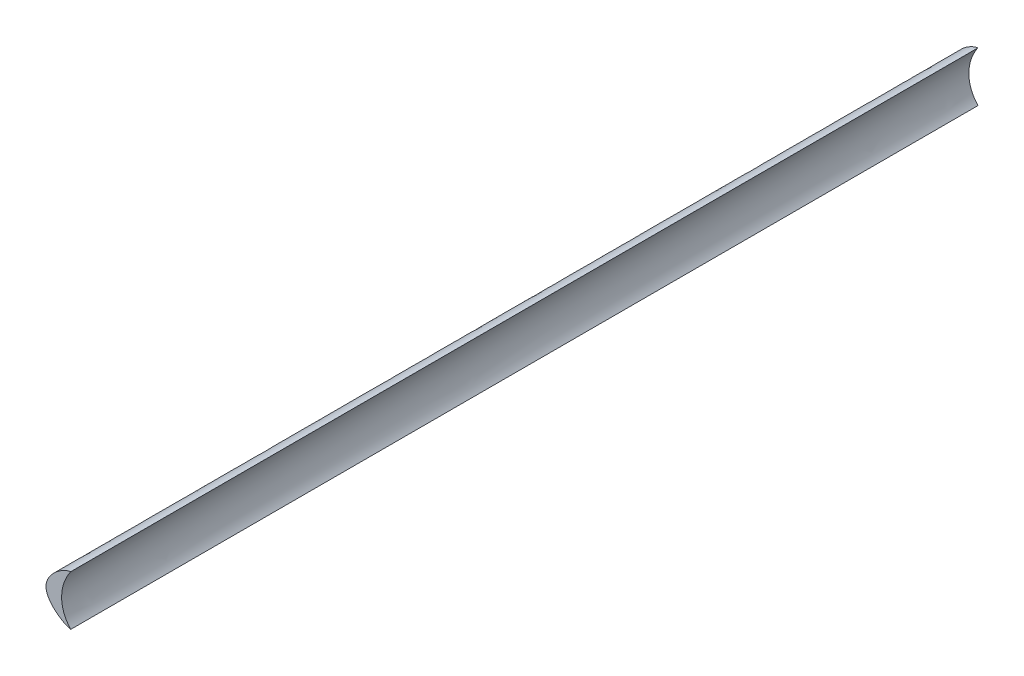
from build123d import *

# Parameters (mm, degrees)
BOSS_EXTRUDE1_DEPTH      = 350
BOSS_EXTRUDE1_DEPTH_BACK = 350


with BuildPart() as part:
    # Sketch2 → Boss-Extrude1 (new, two sides: drawn at the far end of the back side and taken through both)
    with BuildSketch(Plane.XY.offset(-BOSS_EXTRUDE1_DEPTH_BACK)):
        with BuildLine():
            add(Edge.make_bspline(
                [(1.233824634, 18.794499467), (-6.88060644, 7.631583164), (-9.36316199, -8.534550751), (1.233824634, -19.775180741)],
                knots=[0, 0, 0, 0, 1, 1, 1, 1], degree=3))
            add(Edge.make_bspline(
                [(1.233824634, 18.794499467), (-6.380214916, 17.552345059), (-29.933808279, -1.203216859), (-5.334113331, -18.623266636), (1.233824634, -19.775180741)],
                knots=[0, 0, 0, 0, 0.514535378, 1, 1, 1, 1], degree=3))
        make_face()
    extrude(amount=BOSS_EXTRUDE1_DEPTH + BOSS_EXTRUDE1_DEPTH_BACK)


solid = part.part
